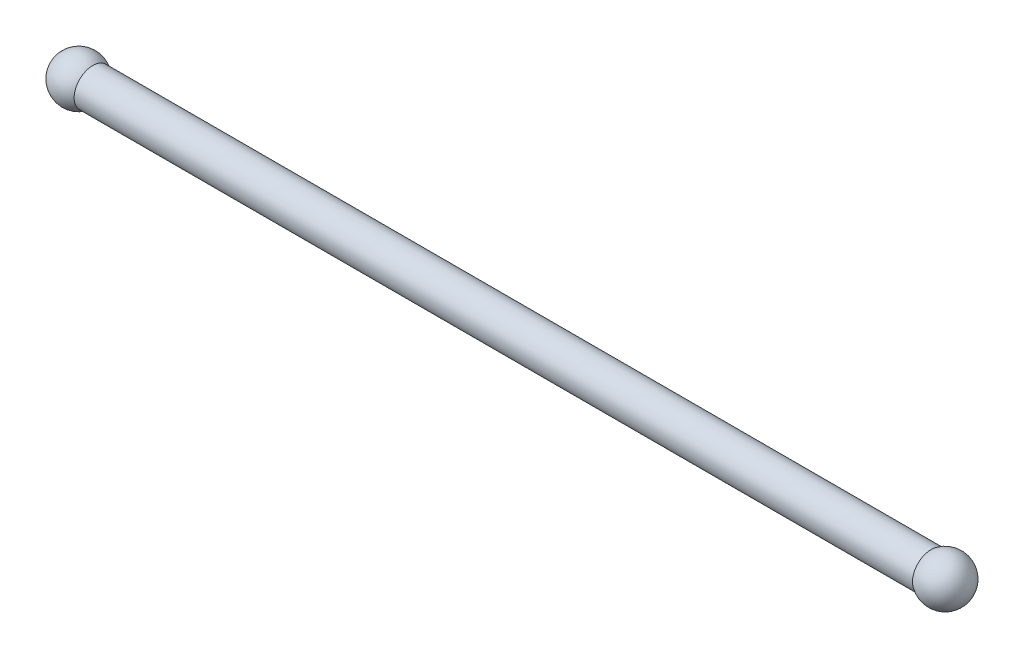
from build123d import *

# Parameters (mm, degrees)
SKETCH1_R           = 1
BOSS_EXTRUDE1_DEPTH = 45
DOME1_FACE_RADIUS   = 1
DOME1_HEIGHT        = 2
DOME2_FACE_RADIUS   = 1
DOME2_HEIGHT        = 2


with BuildPart() as part:
    # Sketch1 → Boss-Extrude1 (new body)
    with BuildSketch(Plane(origin=(0, 0, 0), x_dir=(0, 0, -1), z_dir=(1, 0, 0))):
        with Locations(Location((0, 0, 0), (0, 0, 180))):
            Circle(SKETCH1_R)
    extrude(amount=BOSS_EXTRUDE1_DEPTH)

    # Dome1: a dome of height H over a round flat face of radius A is a cap of a sphere of radius (A * A + H * H) / (2 * H)
    dome1_r = (DOME1_FACE_RADIUS * DOME1_FACE_RADIUS + DOME1_HEIGHT * DOME1_HEIGHT) / (2 * DOME1_HEIGHT)
    dome1_base = Plane((0, 0, 0), z_dir=(-1, 0, 0))
    with Locations(dome1_base.offset(DOME1_HEIGHT - dome1_r)):
        dome1_ball = Sphere(dome1_r, mode=Mode.PRIVATE)
    add(split(dome1_ball, bisect_by=dome1_base, keep=Keep.TOP, mode=Mode.PRIVATE))

    # Dome2: a dome of height H over a round flat face of radius A is a cap of a sphere of radius (A * A + H * H) / (2 * H)
    dome2_r = (DOME2_FACE_RADIUS * DOME2_FACE_RADIUS + DOME2_HEIGHT * DOME2_HEIGHT) / (2 * DOME2_HEIGHT)
    dome2_base = Plane((45, 0, 0), z_dir=(1, 0, 0))
    with Locations(dome2_base.offset(DOME2_HEIGHT - dome2_r)):
        dome2_ball = Sphere(dome2_r, mode=Mode.PRIVATE)
    add(split(dome2_ball, bisect_by=dome2_base, keep=Keep.TOP, mode=Mode.PRIVATE))


solid = part.part
